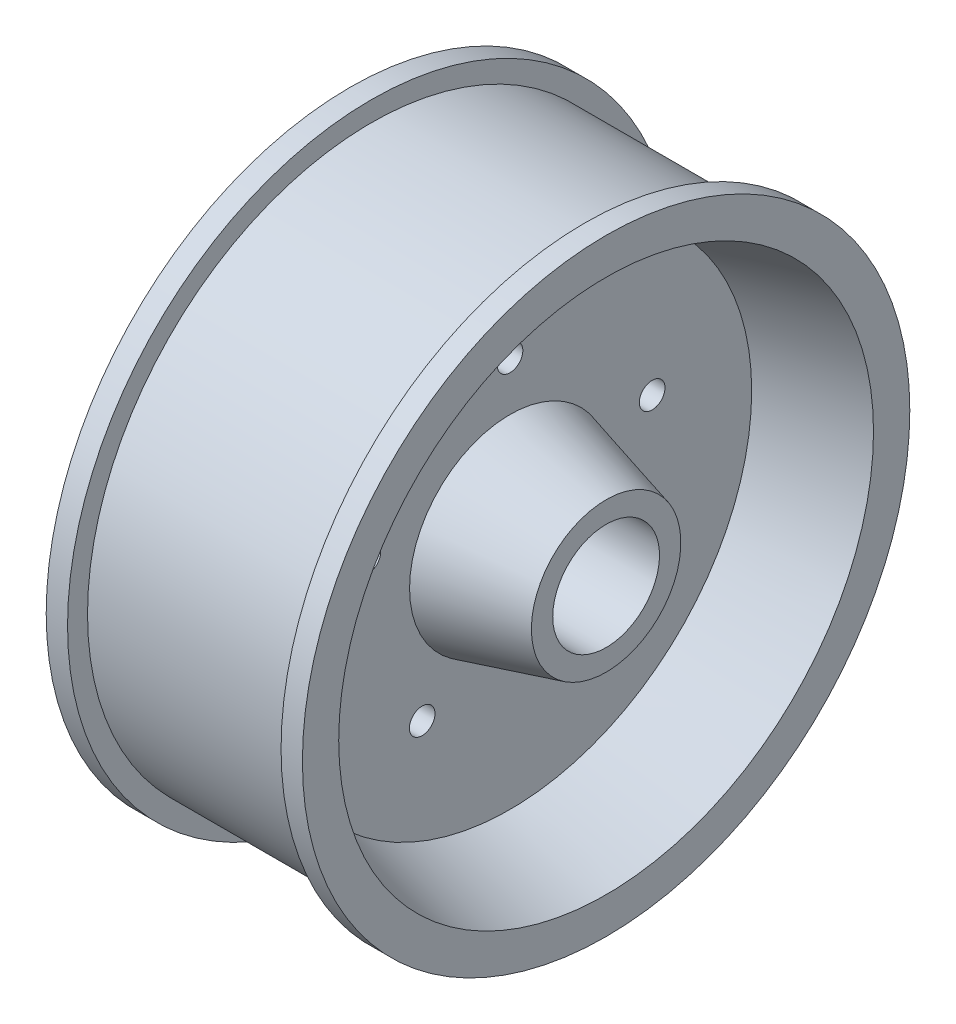
from build123d import *

# Parameters (mm, degrees)
SKETCH2_R          = 3.81
CUT_EXTRUDE1_DEPTH = 137.324658476
CIRPATTERN1_COUNT  = 5


with BuildPart() as part:
    # Sketch1 → Revolve2 (revolve)
    with BuildSketch(Plane.XY, mode=Mode.PRIVATE) as revolve2_sk:
        Polygon((38.1, 90.3224), (31.75, 90.3224), (31.75, 84.380681481), (-31.75, 84.380681481), (-31.75, 90.3224), (-38.1, 90.3224), (-38.1, 79.5274), (-9.525, 71.870751826), (-9.525, 29.881648174), (-38.1, 22.225), (-38.1, 15.875), (38.1, 15.875), (38.1, 22.225), (9.525, 29.881648174), (9.525, 71.870751826), (38.1, 79.5274), align=None)
    revolve(revolve2_sk.sketch.rotate(Axis((-1499.65664488, 0, 0), (1, 0, 0)), 90), axis=Axis((-1499.65664488, 0, 0), (1, 0, 0)))

    # Sketch2 → Cut-Extrude1 (cut, through all)
    with BuildSketch(Plane(origin=(9.525, 0, 0), x_dir=(0, 0, -1), z_dir=(1, 0, 0))):
        with Locations((0, 44.45)):
            Circle(SKETCH2_R)
    cut_extrude1 = extrude(amount=-CUT_EXTRUDE1_DEPTH, mode=Mode.SUBTRACT)

    # CirPattern1: Cut-Extrude1 ×5 about axis
    cirpattern1_axis = Axis((0, 0, 0), (1, 0, 0))
    for i in range(1, CIRPATTERN1_COUNT):
        add(cut_extrude1.rotate(cirpattern1_axis, i * 360 / CIRPATTERN1_COUNT), mode=Mode.SUBTRACT)


solid = part.part
